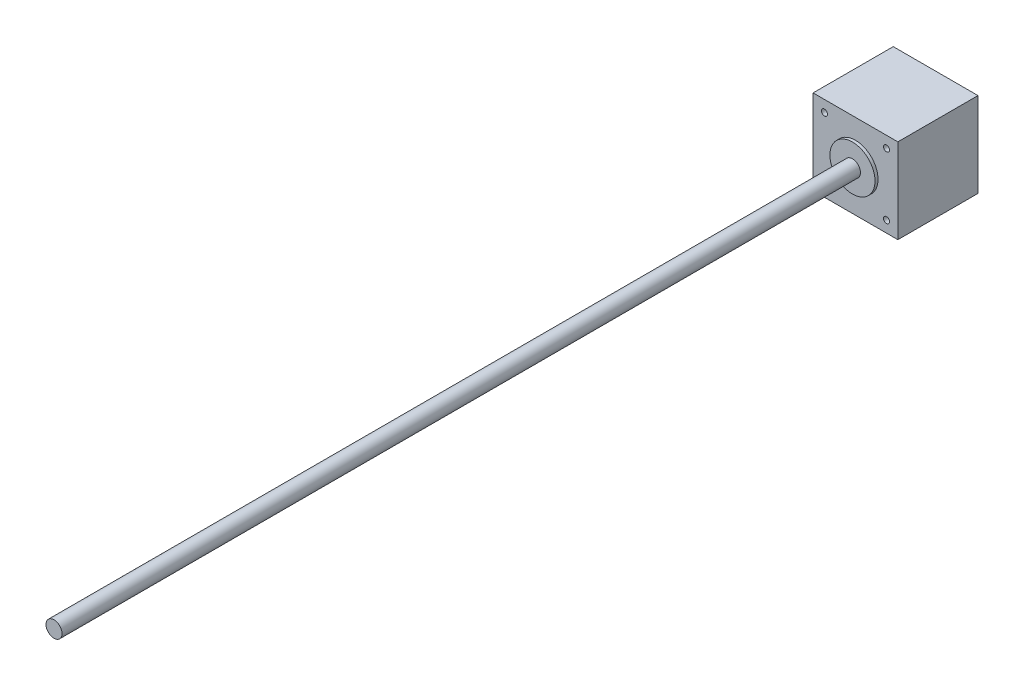
from build123d import *

# Parameters (mm, degrees)
SKETCH1_W           = 42.3
SKETCH1_H           = 42.3
BOSS_EXTRUDE1_DEPTH = 40
SKETCH1_3_R         = 1.5
CUT_EXTRUDE1_DEPTH  = 5
SKETCH1_4_R         = 11.25
SKETCH1_4_R_2       = 4
BOSS_EXTRUDE2_DEPTH = 1.5
SKETCH1_5_R         = 4
BOSS_EXTRUDE3_DEPTH = 400
SKETCH3_W           = 17
SKETCH3_H           = 9
BOSS_EXTRUDE4_DEPTH = 5


with BuildPart() as part:
    # Sketch1 → Boss-Extrude1 (new body)
    with BuildSketch(Plane.XY):
        Rectangle(SKETCH1_W, SKETCH1_H)
    extrude(amount=-BOSS_EXTRUDE1_DEPTH)

    # Sketch1<3> → Cut-Extrude1 (cut)
    with BuildSketch(Plane.XY):
        with Locations((15.5, 15.5)):
            Circle(SKETCH1_3_R)
        with Locations((15.5, -15.5)):
            Circle(SKETCH1_3_R)
        with Locations((-15.5, -15.5)):
            Circle(SKETCH1_3_R)
        with Locations((-15.5, 15.5)):
            Circle(SKETCH1_3_R)
    extrude(amount=-CUT_EXTRUDE1_DEPTH, mode=Mode.SUBTRACT)

    # Sketch1<4> → Boss-Extrude2 (add)
    with BuildSketch(Plane.XY):
        Circle(SKETCH1_4_R)
        Circle(SKETCH1_4_R_2, mode=Mode.SUBTRACT)
    extrude(amount=BOSS_EXTRUDE2_DEPTH)

    # Sketch1<5> → Boss-Extrude3 (add)
    with BuildSketch(Plane.XY):
        Circle(SKETCH1_5_R)
    extrude(amount=BOSS_EXTRUDE3_DEPTH)

    # Sketch3 → Boss-Extrude4 (add)
    with BuildSketch(Plane.XZ.offset(21.15)):
        with Locations((0, -35.5)):
            Rectangle(SKETCH3_W, SKETCH3_H)
    extrude(amount=BOSS_EXTRUDE4_DEPTH)


solid = part.part
